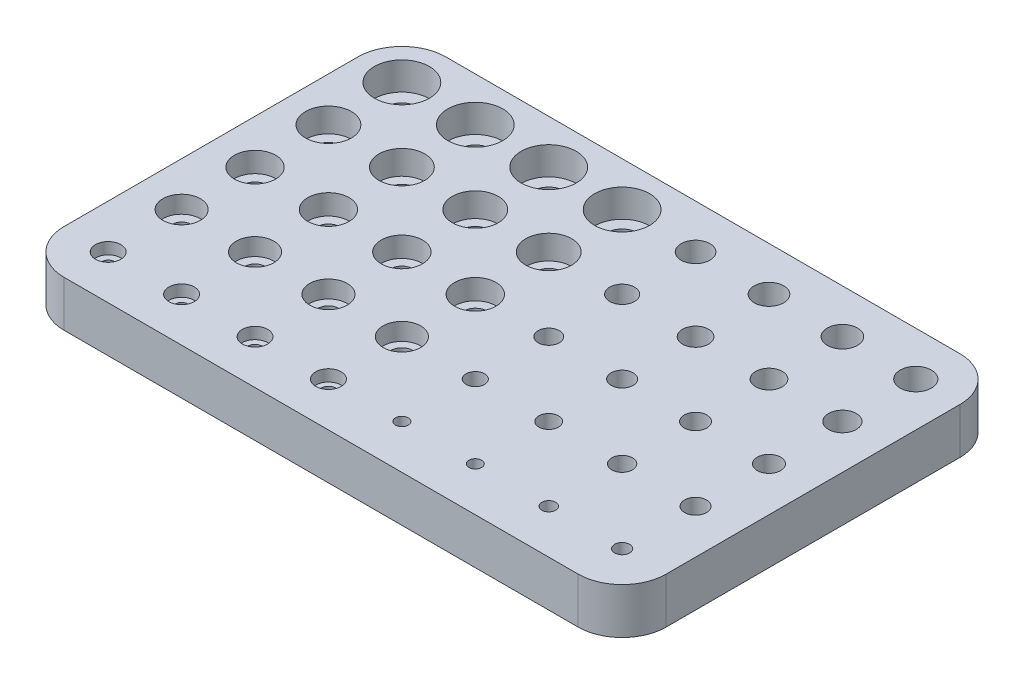
from build123d import *

# Parameters (mm, degrees)
SKETCH1_W                                       = 53.34
SKETCH1_H                                       = 66.04
SKETCH1_R                                       = 2.5527
SKETCH1_R_2                                     = 2.60985
SKETCH1_R_3                                     = 2.7051
SKETCH1_R_4                                     = 2.4003
SKETCH1_R_5                                     = 2.3114
SKETCH1_R_6                                     = 2.2479
SKETCH1_R_7                                     = 1.89865
SKETCH1_R_8                                     = 1.9558
SKETCH1_R_9                                     = 2.0193
SKETCH1_R_10                                    = 1.9
SKETCH1_R_11                                    = 1.8
SKETCH1_R_12                                    = 1.7
SKETCH1_R_13                                    = 1.1
SKETCH1_R_14                                    = 1.2
SKETCH1_R_15                                    = 1.3
SKETCH1_R_16                                    = 2.4892
SKETCH1_R_17                                    = 2.15265
SKETCH1_R_18                                    = 1.8288
SKETCH1_R_19                                    = 1.6
BOSS_EXTRUDE1_DEPTH                             = 7.9375
LPATTERN1_COUNT                                 = 2
LPATTERN1_PITCH                                 = 50.8
CBORE_FOR_10_SOCKET_HEAD_CAP_SCREW1_D           = 4.9784
CBORE_FOR_10_SOCKET_HEAD_CAP_SCREW1_CBORE_D     = 9.525
CBORE_FOR_10_SOCKET_HEAD_CAP_SCREW1_CBORE_DEPTH = 4.826
CBORE_FOR_8_SOCKET_HEAD_CAP_SCREW1_D            = 4.3053
CBORE_FOR_8_SOCKET_HEAD_CAP_SCREW1_CBORE_D      = 7.9375
CBORE_FOR_8_SOCKET_HEAD_CAP_SCREW1_CBORE_DEPTH  = 4.1656
CBORE_FOR_6_SOCKET_HEAD_CAP_SCREW1_D            = 3.6576
CBORE_FOR_6_SOCKET_HEAD_CAP_SCREW1_CBORE_D      = 7.14502
CBORE_FOR_6_SOCKET_HEAD_CAP_SCREW1_CBORE_DEPTH  = 3.5052
CBORE_FOR_M3_SHCS1_D                            = 3.2
CBORE_FOR_M3_SHCS1_CBORE_D                      = 6.5
CBORE_FOR_M3_SHCS1_CBORE_DEPTH                  = 3
CBORE_FOR_M2_SHCS1_D                            = 2.2
CBORE_FOR_M2_SHCS1_CBORE_D                      = 4.4
CBORE_FOR_M2_SHCS1_CBORE_DEPTH                  = 2
FILLET1_R                                       = 7.62


with BuildPart() as part:
    # Sketch1 → Boss-Extrude1 (new body)
    with BuildSketch(Plane(origin=(0, 0, 0), x_dir=(1, 0, 0), z_dir=(0, 1, 0))):
        with Locations((26.67, 33.02)):
            Rectangle(SKETCH1_W, SKETCH1_H)
        with Locations((20.32, 58.42)):
            Circle(SKETCH1_R, mode=Mode.SUBTRACT)
        with Locations((33.02, 58.42)):
            Circle(SKETCH1_R_2, mode=Mode.SUBTRACT)
        with Locations((45.72, 58.42)):
            Circle(SKETCH1_R_3, mode=Mode.SUBTRACT)
        with Locations((45.72, 45.72)):
            Circle(SKETCH1_R_4, mode=Mode.SUBTRACT)
        with Locations((33.02, 45.72)):
            Circle(SKETCH1_R_5, mode=Mode.SUBTRACT)
        with Locations((20.32, 45.72)):
            Circle(SKETCH1_R_6, mode=Mode.SUBTRACT)
        with Locations((20.32, 33.02)):
            Circle(SKETCH1_R_7, mode=Mode.SUBTRACT)
        with Locations((33.02, 33.02)):
            Circle(SKETCH1_R_8, mode=Mode.SUBTRACT)
        with Locations((45.72, 33.02)):
            Circle(SKETCH1_R_9, mode=Mode.SUBTRACT)
        with Locations((45.72, 20.32)):
            Circle(SKETCH1_R_10, mode=Mode.SUBTRACT)
        with Locations((33.02, 20.32)):
            Circle(SKETCH1_R_11, mode=Mode.SUBTRACT)
        with Locations((20.32, 20.32)):
            Circle(SKETCH1_R_12, mode=Mode.SUBTRACT)
        with Locations((20.32, 7.62)):
            Circle(SKETCH1_R_13, mode=Mode.SUBTRACT)
        with Locations((33.02, 7.62)):
            Circle(SKETCH1_R_14, mode=Mode.SUBTRACT)
        with Locations((45.72, 7.62)):
            Circle(SKETCH1_R_15, mode=Mode.SUBTRACT)
        with Locations((7.62, 58.42)):
            Circle(SKETCH1_R_16, mode=Mode.SUBTRACT)
        with Locations((7.62, 45.72)):
            Circle(SKETCH1_R_17, mode=Mode.SUBTRACT)
        with Locations((7.62, 33.02)):
            Circle(SKETCH1_R_18, mode=Mode.SUBTRACT)
        with Locations((7.62, 7.62)):
            Circle(SKETCH1_R_13, mode=Mode.SUBTRACT)
        with Locations((7.62, 20.32)):
            Circle(SKETCH1_R_19, mode=Mode.SUBTRACT)
    extrude(amount=-BOSS_EXTRUDE1_DEPTH)


with BuildPart() as lpattern1_1:
    # LPattern1: pattern copy
    add(part.part.moved(Location(Vector(1, 0, 0) * (1 * LPATTERN1_PITCH))))

    # Combine1: union part
    add(part.part)

    # CBORE for #10 Socket Head Cap Screw1 (through all)
    with Locations(Plane(origin=(0, 0, 0), x_dir=(1, 0, 0), z_dir=(0, 1, 0))):
        with Locations((7.62, 58.42), (20.32, 58.42), (33.02, 58.42), (45.72, 58.42)):
            CounterBoreHole(CBORE_FOR_10_SOCKET_HEAD_CAP_SCREW1_D / 2, CBORE_FOR_10_SOCKET_HEAD_CAP_SCREW1_CBORE_D / 2, CBORE_FOR_10_SOCKET_HEAD_CAP_SCREW1_CBORE_DEPTH)

    # CBORE for #8 Socket Head Cap Screw1 (through all)
    with Locations(Plane(origin=(0, 0, 0), x_dir=(1, 0, 0), z_dir=(0, 1, 0))):
        with Locations((7.62, 45.72), (20.32, 45.72), (33.02, 45.72), (45.72, 45.72)):
            CounterBoreHole(CBORE_FOR_8_SOCKET_HEAD_CAP_SCREW1_D / 2, CBORE_FOR_8_SOCKET_HEAD_CAP_SCREW1_CBORE_D / 2, CBORE_FOR_8_SOCKET_HEAD_CAP_SCREW1_CBORE_DEPTH)

    # CBORE for #6 Socket Head Cap Screw1 (through all)
    with Locations(Plane(origin=(0, 0, 0), x_dir=(1, 0, 0), z_dir=(0, 1, 0))):
        with Locations((7.62, 33.02), (20.32, 33.02), (33.02, 33.02), (45.72, 33.02)):
            CounterBoreHole(CBORE_FOR_6_SOCKET_HEAD_CAP_SCREW1_D / 2, CBORE_FOR_6_SOCKET_HEAD_CAP_SCREW1_CBORE_D / 2, CBORE_FOR_6_SOCKET_HEAD_CAP_SCREW1_CBORE_DEPTH)

    # CBORE for M3 SHCS1 (through all)
    with Locations(Plane(origin=(0, 0, 0), x_dir=(1, 0, 0), z_dir=(0, 1, 0))):
        with Locations((7.62, 20.32), (20.32, 20.32), (33.02, 20.32), (45.72, 20.32)):
            CounterBoreHole(CBORE_FOR_M3_SHCS1_D / 2, CBORE_FOR_M3_SHCS1_CBORE_D / 2, CBORE_FOR_M3_SHCS1_CBORE_DEPTH)

    # CBORE for M2 SHCS1 (through all)
    with Locations(Plane(origin=(0, 0, 0), x_dir=(1, 0, 0), z_dir=(0, 1, 0))):
        with Locations((7.62, 7.62), (20.32, 7.62), (33.02, 7.62), (45.72, 7.62)):
            CounterBoreHole(CBORE_FOR_M2_SHCS1_D / 2, CBORE_FOR_M2_SHCS1_CBORE_D / 2, CBORE_FOR_M2_SHCS1_CBORE_DEPTH)

    # Fillet1
    fillet1_edges = [lpattern1_1.edges().sort_by_distance(p)[0] for p in [
        (104.14, -3.96875, -66.04),
        (104.14, -3.96875, 0),
        (0, -3.96875, -66.04),
        (0, -3.96875, 0),
    ]]
    fillet(fillet1_edges, radius=FILLET1_R)


solid = lpattern1_1.part
